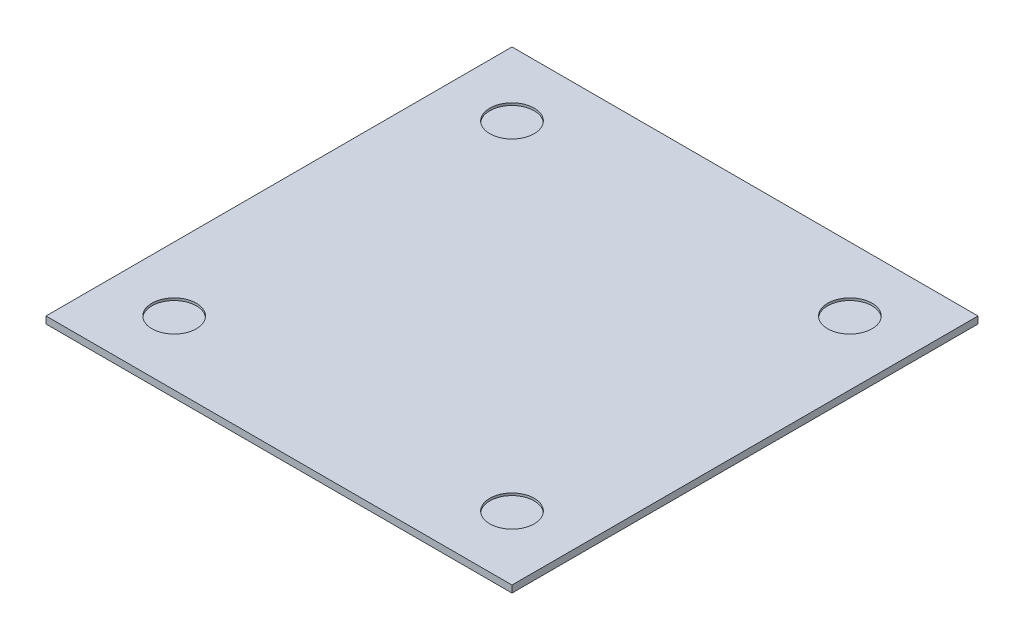
from build123d import *

# Parameters (mm, degrees)
SKETCH1_W           = 200
SKETCH1_H           = 200
BOSS_EXTRUDE1_DEPTH = 3
SKETCH2_R           = 9.525
CUT_EXTRUDE1_DEPTH  = 1


with BuildPart() as part:
    # Sketch1 → Boss-Extrude1 (new body)
    with BuildSketch(Plane(origin=(0, 0, 0), x_dir=(1, 0, 0), z_dir=(0, 1, 0))):
        Rectangle(SKETCH1_W, SKETCH1_H)
    extrude(amount=BOSS_EXTRUDE1_DEPTH)

    # Sketch2 → Cut-Extrude1 (cut)
    with BuildSketch(Plane(origin=(0, 3, 0), x_dir=(1, 0, 0), z_dir=(0, 1, 0))):
        with Locations(Location((-72.505426733, 72.505426733, 0), (0, 0, 270))):
            Circle(SKETCH2_R)
        with Locations(Location((72.505426733, 72.505426733, 0), (0, 0, 270))):
            Circle(SKETCH2_R)
        with Locations(Location((72.505426733, -72.505426733, 0), (0, 0, 270))):
            Circle(SKETCH2_R)
        with Locations(Location((-72.505426733, -72.505426733, 0), (0, 0, 270))):
            Circle(SKETCH2_R)
    extrude(amount=-CUT_EXTRUDE1_DEPTH, mode=Mode.SUBTRACT)


solid = part.part
